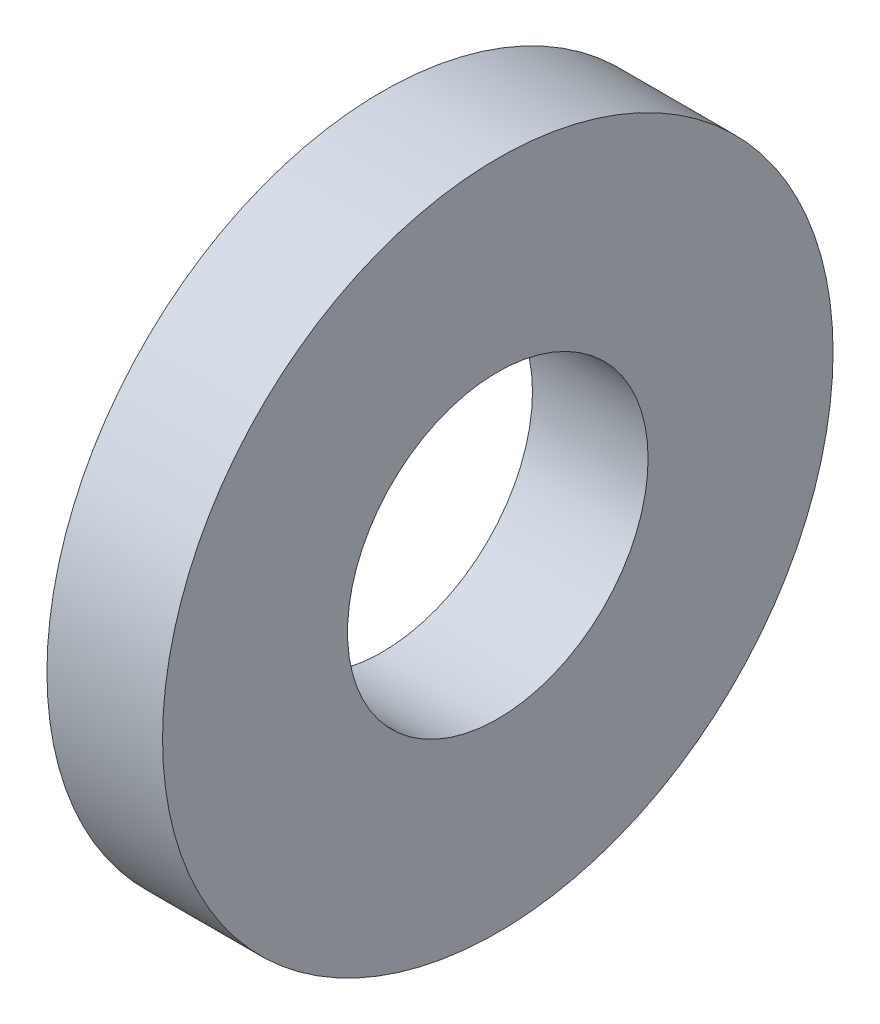
from build123d import *

# Parameters (mm, degrees)
CROQUIS2_R              = 7.25
CROQUIS2_R_2            = 3.25
SALIENTE_EXTRUIR1_DEPTH = 1.25


with BuildPart() as part:
    # Croquis2 → Saliente-Extruir1 (new, symmetric)
    with BuildSketch(Plane(origin=(0, 0, 0), x_dir=(0, 0, -1), z_dir=(1, 0, 0))):
        Circle(CROQUIS2_R)
        Circle(CROQUIS2_R_2, mode=Mode.SUBTRACT)
    extrude(amount=SALIENTE_EXTRUIR1_DEPTH, both=True)


solid = part.part
